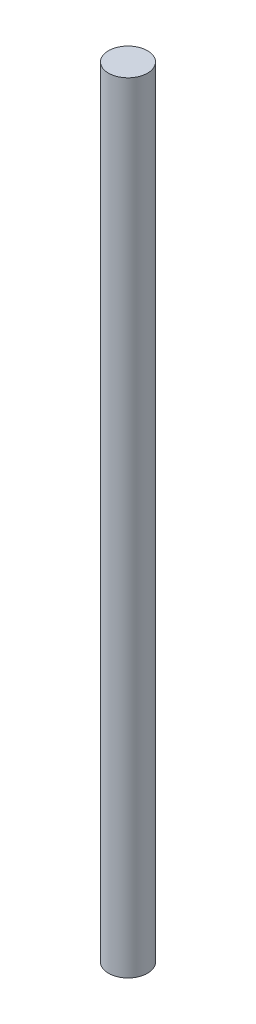
from build123d import *

# Parameters (mm, degrees)
SKETCH1_R           = 2
BOSS_EXTRUDE1_DEPTH = 80


with BuildPart() as part:
    # Sketch1 → Boss-Extrude1 (new body)
    with BuildSketch(Plane(origin=(0, 0, 0), x_dir=(1, 0, 0), z_dir=(0, 1, 0))):
        with Locations(Location((0, 0, 0), (0, 0, 270))):
            Circle(SKETCH1_R)
    extrude(amount=BOSS_EXTRUDE1_DEPTH)


solid = part.part
